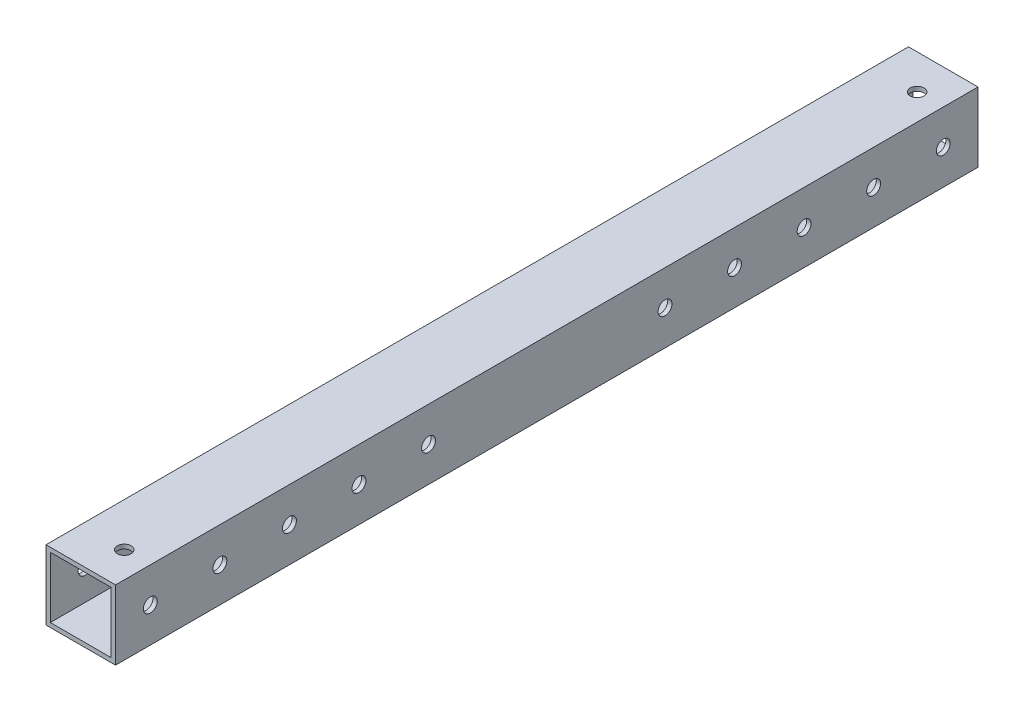
from build123d import *

# Parameters (mm, degrees)
SKETCH1_W           = 25.4
SKETCH1_H           = 25.4
SKETCH1_W_2         = 22.225
SKETCH1_H_2         = 22.225
BOSS_EXTRUDE1_DEPTH = 314.96
SKETCH3_R           = 2.54
CUT_EXTRUDE2_DEPTH  = 318.00176908
SKETCH4_R           = 2.54
CUT_EXTRUDE3_DEPTH  = 318.00176908


with BuildPart() as part:
    # Sketch1 → Boss-Extrude1 (new body)
    with BuildSketch(Plane.XY):
        with Locations((12.7, 12.7)):
            Rectangle(SKETCH1_W, SKETCH1_H)
        with Locations((12.7, 12.7)):
            Rectangle(SKETCH1_W_2, SKETCH1_H_2, mode=Mode.SUBTRACT)
    extrude(amount=BOSS_EXTRUDE1_DEPTH)

    # Sketch3 → Cut-Extrude2 (cut, through all)
    with BuildSketch(Plane(origin=(0, 25.4, 0), x_dir=(1, 0, 0), z_dir=(0, 1, 0))):
        with Locations(Location((15.875, -302.26, 0), (0, 0, 270))):
            Circle(SKETCH3_R)
        with Locations(Location((15.875, -12.7, 0), (0, 0, 270))):
            Circle(SKETCH3_R)
    extrude(amount=-CUT_EXTRUDE2_DEPTH, mode=Mode.SUBTRACT)

    # Sketch4 → Cut-Extrude3 (cut, through all)
    with BuildSketch(Plane(origin=(25.4, 0, 0), x_dir=(0, 0, -1), z_dir=(1, 0, 0))):
        with Locations((-302.26, 12.7)):
            Circle(SKETCH4_R)
        with Locations((-276.86, 12.7)):
            Circle(SKETCH4_R)
        with Locations((-251.46, 12.7)):
            Circle(SKETCH4_R)
        with Locations((-226.06, 12.7)):
            Circle(SKETCH4_R)
        with Locations((-200.66, 12.7)):
            Circle(SKETCH4_R)
        with Locations(Location((-114.3, 12.7, 0), (0, 0, 180))):
            Circle(SKETCH4_R)
        with Locations(Location((-88.9, 12.7, 0), (0, 0, 180))):
            Circle(SKETCH4_R)
        with Locations(Location((-63.5, 12.7, 0), (0, 0, 180))):
            Circle(SKETCH4_R)
        with Locations(Location((-38.1, 12.7, 0), (0, 0, 180))):
            Circle(SKETCH4_R)
        with Locations(Location((-12.7, 12.7, 0), (0, 0, 180))):
            Circle(SKETCH4_R)
    extrude(amount=-CUT_EXTRUDE3_DEPTH, mode=Mode.SUBTRACT)


solid = part.part
